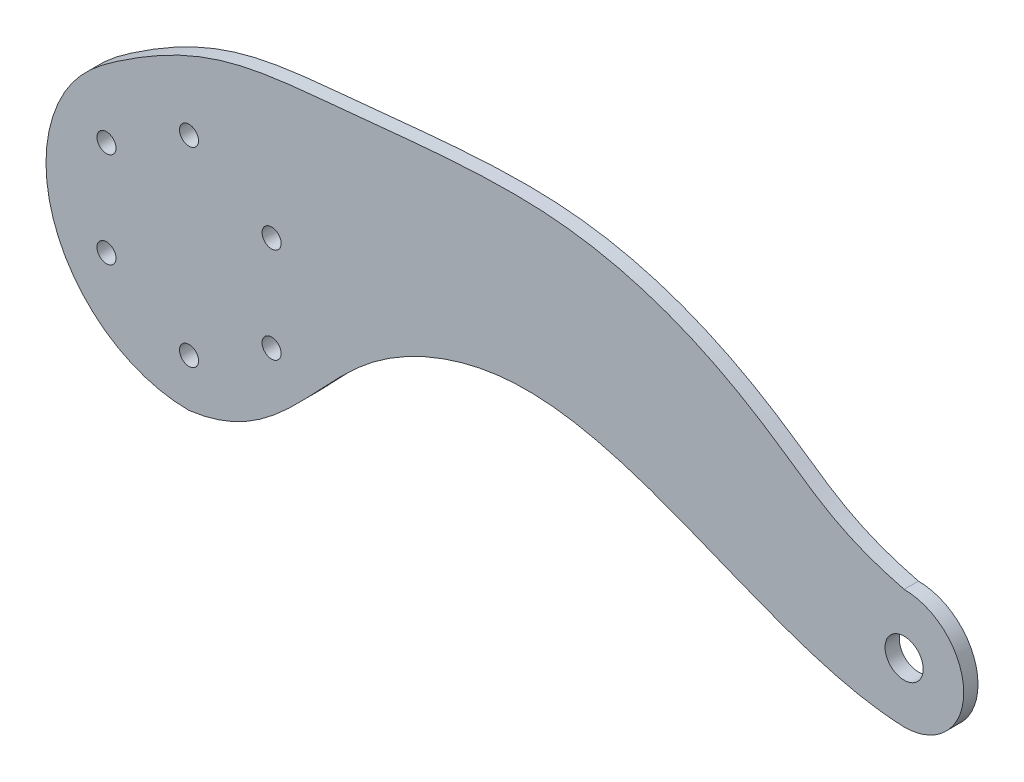
from build123d import *

# Parameters (mm, degrees)
SKETCH1_R           = 2
SKETCH1_R_2         = 4
BOSS_EXTRUDE3_DEPTH = 3


with BuildPart() as part:
    # Sketch1 → Boss-Extrude3 (new body)
    with BuildSketch(Plane.XY):
        with BuildLine():
            add(Edge.make_bspline(
                [(-26.063461661, 14.855839466), (-22.995207495, 20.238862419), (-18.617864266, 23.494747377), (-14.633714845, 26.188821849)],
                knots=[0, 0, 0, 0, 0.056043779, 0.056043779, 0.056043779, 0.056043779], degree=3))
            ThreePointArc((-26.063461661, 14.855839466), (-25.939113169, -15.071907909), (0, -30))
            add(Edge.make_bspline(
                [(0, -30), (17.93675339, -27.745895163), (30.170167076, -2.352031791), (85.215870065, 19.611994815), (122.19936238, -11.53423425), (150, -12.5)],
                knots=[0, 0, 0, 0, 0.288188908, 0.475939829, 1, 1, 1, 1], degree=3))
            ThreePointArc((150, -12.5), (154.015063849, -11.837620635), (157.604608427, -9.920681966))
            add(Edge.make_bspline(
                [(157.604608427, -9.920681966), (158.523147842, -9.170588579), (159.428456142, -8.206961361)],
                knots=[0.991193685, 0.991193685, 0.991193685, 1, 1, 1], degree=2))
            ThreePointArc((159.428456142, -8.206961361), (161.376225583, 5.179912306), (150, 12.5))
            add(Edge.make_bspline(
                [(-14.633714845, 26.188821849), (4.471910737, 39.10801054), (20.159751535, 39.107737434), (86.741615763, 46.999815307), (125.812924925, 25.830072722), (135.882657692, 16.075482759), (150, 12.5)],
                knots=[0.056043779, 0.056043779, 0.056043779, 0.056043779, 0.324796613, 0.474987684, 0.725167046, 0.945335071, 0.945335071, 0.945335071, 0.945335071], degree=3))
        make_face()
        with Locations((17.320508076, 10)):
            Circle(SKETCH1_R, mode=Mode.SUBTRACT)
        with Locations((0, 20)):
            Circle(SKETCH1_R, mode=Mode.SUBTRACT)
        with Locations((-17.320508076, 10)):
            Circle(SKETCH1_R, mode=Mode.SUBTRACT)
        with Locations((-17.320508076, -10)):
            Circle(SKETCH1_R, mode=Mode.SUBTRACT)
        with Locations((0, -20)):
            Circle(SKETCH1_R, mode=Mode.SUBTRACT)
        with Locations((17.320508076, -10)):
            Circle(SKETCH1_R, mode=Mode.SUBTRACT)
        with Locations((150, 0)):
            Circle(SKETCH1_R_2, mode=Mode.SUBTRACT)
    extrude(amount=BOSS_EXTRUDE3_DEPTH)


solid = part.part
